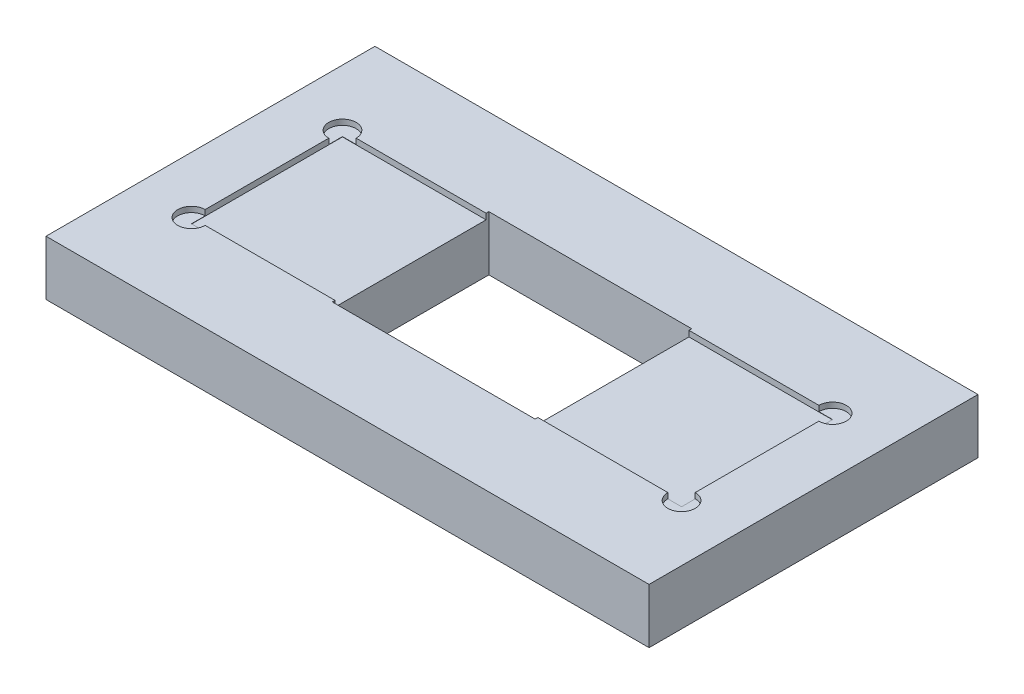
from build123d import *

# Parameters (mm, degrees)
SKETCH1_W               = 220
SKETCH1_H               = 120
BOSS_EXTRUDE1_DEPTH     = 20
SKETCH2_W               = 178.8
SKETCH2_H               = 55.1
CUT_EXTRUDE1_DEPTH      = 2.1
SKETCH3_R               = 5
CUT_EXTRUDE2_DEPTH      = 2
CUT_EXTRUDE3_DEPTH      = 127.571758303
CUT_EXTRUDE3_DEPTH_BACK = 127.571758303
SKETCH4_W               = 74
SKETCH4_H               = 57.1


with BuildPart() as part:
    # Sketch1 → Boss-Extrude1 (new body)
    with BuildSketch(Plane(origin=(0, 0, 0), x_dir=(1, 0, 0), z_dir=(0, 1, 0))):
        Rectangle(SKETCH1_W, SKETCH1_H)
    extrude(amount=-BOSS_EXTRUDE1_DEPTH)

    # Sketch2 → Cut-Extrude1 (cut)
    with BuildSketch(Plane(origin=(0, 0, 0), x_dir=(1, 0, 0), z_dir=(0, 1, 0))):
        Rectangle(SKETCH2_W, SKETCH2_H)
    extrude(amount=-CUT_EXTRUDE1_DEPTH, mode=Mode.SUBTRACT)

    # Sketch3 → Cut-Extrude2 (cut)
    with BuildSketch(Plane(origin=(0, 0, 0), x_dir=(1, 0, 0), z_dir=(0, 1, 0))):
        with Locations((-89.4, 27.55)):
            Circle(SKETCH3_R)
        with Locations((89.4, 27.55)):
            Circle(SKETCH3_R)
        with Locations((89.4, -27.55)):
            Circle(SKETCH3_R)
        with Locations((-89.4, -27.55)):
            Circle(SKETCH3_R)
    extrude(amount=-CUT_EXTRUDE2_DEPTH, mode=Mode.SUBTRACT)

    # Sketch4 → Cut-Extrude3 (cut, two sides: drawn at the far end of the back side and taken through both)
    with BuildSketch(Plane(origin=(0, -2.1, 0), x_dir=(1, 0, 0), z_dir=(0, 1, 0)).offset(-CUT_EXTRUDE3_DEPTH_BACK)):
        Rectangle(SKETCH4_W, SKETCH4_H)
    extrude(amount=CUT_EXTRUDE3_DEPTH + CUT_EXTRUDE3_DEPTH_BACK, mode=Mode.SUBTRACT)


solid = part.part
